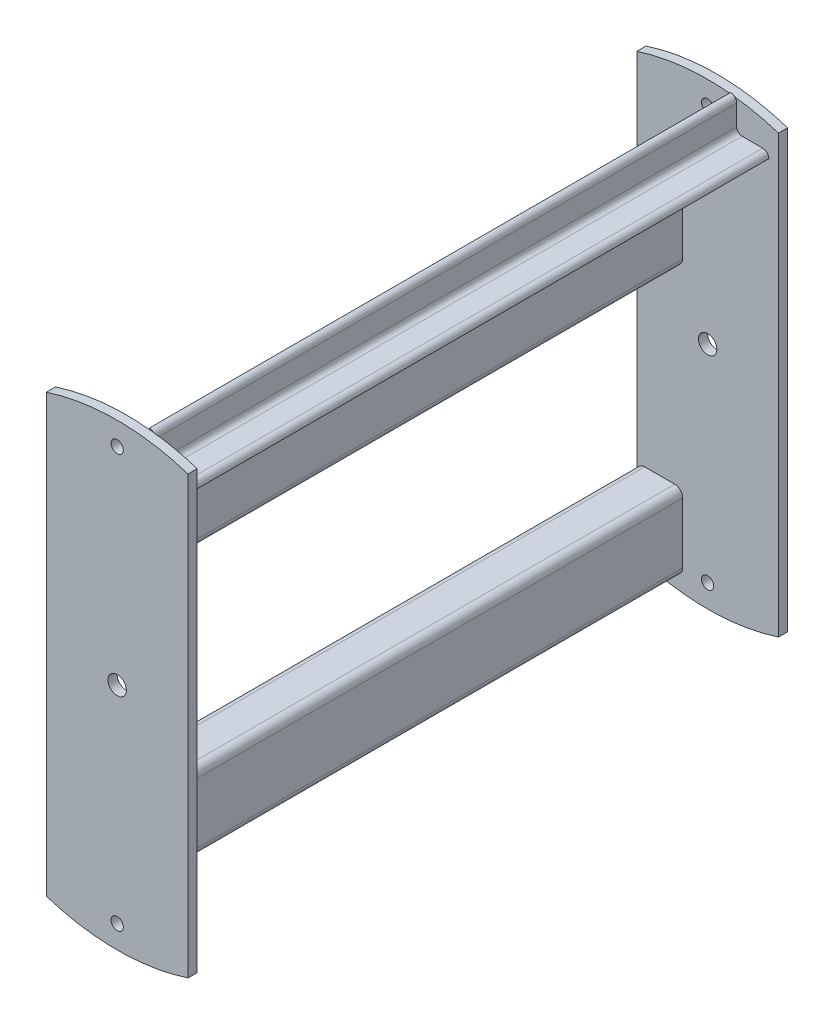
from build123d import *

# Parameters (mm, degrees)
SZKIC1_R                                 = 150
DODANIE_WYCI_GNI_CIE1_DEPTH              = 6
OTWORY_USTALAJ_CE_12_0MM1_D              = 12
OTWORY_USTALAJ_CE_8_0MM1_D               = 8
WYTNIJ_WYCI_GNI_CIE1_DEPTH               = 6
RURA_PROSTOK_TNA_50_X_30_X_2_6_1_DEPTH   = 380
RURA_PROSTOK_TNA_50_X_30_X_2_6_1_2_DEPTH = 380
SZYK_LINIOWY1_COUNT                      = 2
SZYK_LINIOWY1_PITCH                      = 386
K_TOWNIK_STALOWY_25_X_25_X_4_1_DEPTH     = 380


with BuildPart() as part:
    # Szkic1 → Dodanie-wyciągnięcie1 (new body)
    with BuildSketch(Plane.XY):
        Circle(SZKIC1_R)
    extrude(amount=DODANIE_WYCI_GNI_CIE1_DEPTH)

    # Otwory ustalające Ø12.0mm1 (through all)
    with Locations(Plane(origin=(0, 0, 0), x_dir=(-1, 0, 0), z_dir=(0, 0, -1))):
        with Locations((0, 0)):
            Hole(OTWORY_USTALAJ_CE_12_0MM1_D / 2)

    # Otwory ustalające Ø8.0mm1 (through all)
    with Locations(Plane(origin=(0, 0, 0), x_dir=(-1, 0, 0), z_dir=(0, 0, -1))):
        with Locations((0, 135), (0, -135)):
            Hole(OTWORY_USTALAJ_CE_8_0MM1_D / 2)

    # Szkic6 → Wytnij-wyciągnięcie1 (cut)
    with BuildSketch(Plane(origin=(0, 0, 0), x_dir=(-1, 0, 0), z_dir=(0, 0, -1))):
        Polygon((-243.400950292, -95.523391813), (-46.302343021, -166.47603832), (-46.302343021, 166.47603832), (-223.718932749, 137.774122807), align=None)
        Polygon((46.302343021, 166.47603832), (46.302343021, -166.47603832), (226.868055556, -150.633040936), (218.732821637, 144.597222222), align=None)
    extrude(amount=-WYTNIJ_WYCI_GNI_CIE1_DEPTH, mode=Mode.SUBTRACT)


with BuildPart() as body_2:
    # Sketch14 → Rura prostokątna 50 X 30 X 2.6(1) (new body)
    with BuildSketch(Plane(origin=(-31.302343021, 60, 0), x_dir=(1, 0, 0), z_dir=(0, 0, -1))):
        with BuildLine():
            Line((-9.8, -25), (9.8, -25))
            ThreePointArc((9.8, -25), (13.476955262, -23.476955262), (15, -19.8))
            Line((15, -19.8), (15, 19.8))
            ThreePointArc((15, 19.8), (13.476955262, 23.476955262), (9.8, 25))
            Line((9.8, 25), (-9.8, 25))
            ThreePointArc((-9.8, 25), (-13.476955262, 23.476955262), (-15, 19.8))
            Line((-15, 19.8), (-15, -19.8))
            ThreePointArc((-15, -19.8), (-13.476955262, -23.476955262), (-9.8, -25))
        make_face()
        with BuildLine():
            Line((-9.8, -22.4), (9.8, -22.4))
            ThreePointArc((9.8, -22.4), (11.638477631, -21.638477631), (12.4, -19.8))
            Line((12.4, -19.8), (12.4, 19.8))
            ThreePointArc((12.4, 19.8), (11.638477631, 21.638477631), (9.8, 22.4))
            Line((9.8, 22.4), (-9.8, 22.4))
            ThreePointArc((-9.8, 22.4), (-11.638477631, 21.638477631), (-12.4, 19.8))
            Line((-12.4, 19.8), (-12.4, -19.8))
            ThreePointArc((-12.4, -19.8), (-11.638477631, -21.638477631), (-9.8, -22.4))
        make_face(mode=Mode.SUBTRACT)
    extrude(amount=RURA_PROSTOK_TNA_50_X_30_X_2_6_1_DEPTH)


with BuildPart() as body_3:
    # Sketch14 on segment 2 (carried to segment 2) → Rura prostok_tna 50 X 30 X 2.6_1 2 (new body)
    with BuildSketch(Plane(origin=(-31.302343021, -115, 0), x_dir=(1, 0, 0), z_dir=(0, 0, -1))):
        with BuildLine():
            Line((-9.8, -25), (9.8, -25))
            ThreePointArc((9.8, -25), (13.476955262, -23.476955262), (15, -19.8))
            Line((15, -19.8), (15, 19.8))
            ThreePointArc((15, 19.8), (13.476955262, 23.476955262), (9.8, 25))
            Line((9.8, 25), (-9.8, 25))
            ThreePointArc((-9.8, 25), (-13.476955262, 23.476955262), (-15, 19.8))
            Line((-15, 19.8), (-15, -19.8))
            ThreePointArc((-15, -19.8), (-13.476955262, -23.476955262), (-9.8, -25))
        make_face()
        with BuildLine():
            Line((-9.8, -22.4), (9.8, -22.4))
            ThreePointArc((9.8, -22.4), (11.638477631, -21.638477631), (12.4, -19.8))
            Line((12.4, -19.8), (12.4, 19.8))
            ThreePointArc((12.4, 19.8), (11.638477631, 21.638477631), (9.8, 22.4))
            Line((9.8, 22.4), (-9.8, 22.4))
            ThreePointArc((-9.8, 22.4), (-11.638477631, 21.638477631), (-12.4, 19.8))
            Line((-12.4, 19.8), (-12.4, -19.8))
            ThreePointArc((-12.4, -19.8), (-11.638477631, -21.638477631), (-9.8, -22.4))
        make_face(mode=Mode.SUBTRACT)
    extrude(amount=RURA_PROSTOK_TNA_50_X_30_X_2_6_1_2_DEPTH)


with BuildPart() as szyk_liniowy1_1:
    # Szyk liniowy1: pattern copy
    add(part.part.moved(Location(Vector(0, 0, -1) * (1 * SZYK_LINIOWY1_PITCH))))


with BuildPart() as body_5:
    # Sketch115 → Kątownik stalowy 25 X 25 X 4(1) (new body)
    with BuildSketch(Plane(origin=(15, 125, 0), x_dir=(0, 1, 0), z_dir=(0, 0, -1))):
        with BuildLine():
            Line((0, 0), (0, 25))
            ThreePointArc((0, 25), (2.828427125, 23.828427125), (4, 21))
            Line((4, 21), (4, 7.5))
            ThreePointArc((4, 7.5), (5.025126266, 5.025126266), (7.5, 4))
            Line((7.5, 4), (21, 4))
            ThreePointArc((21, 4), (23.828427125, 2.828427125), (25, 0))
            Line((25, 0), (0, 0))
        make_face()
    extrude(amount=K_TOWNIK_STALOWY_25_X_25_X_4_1_DEPTH)


solid = Compound([part.part, body_2.part, body_3.part, szyk_liniowy1_1.part, body_5.part])
